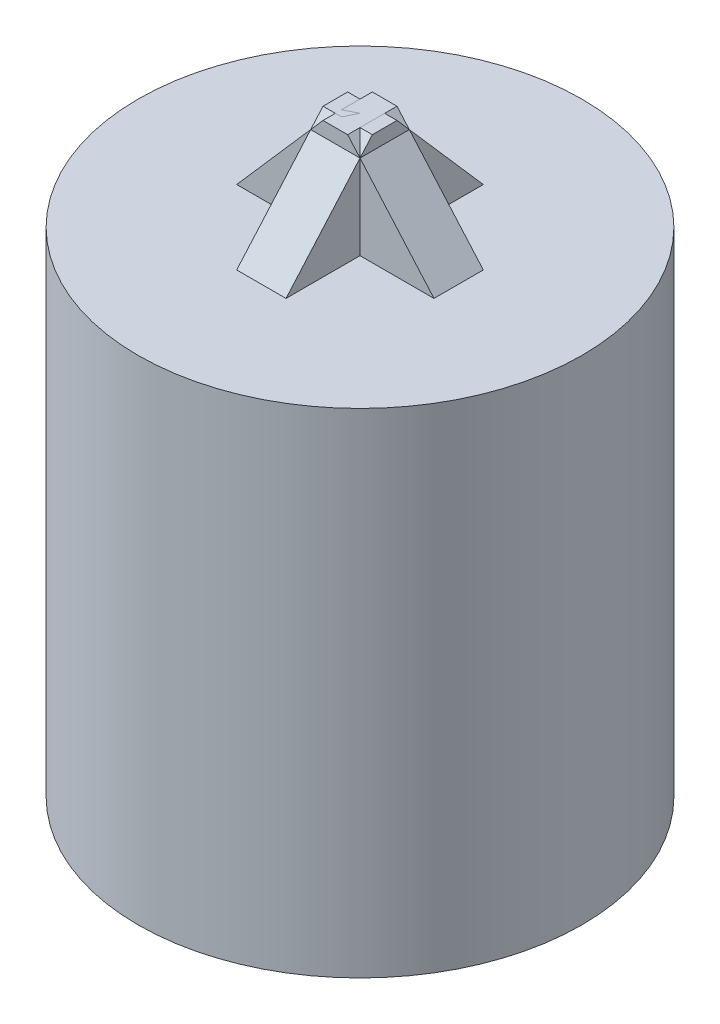
from build123d import *

# Parameters (mm, degrees)
SKETCH_1_R          = 4.5
SKETCH_1_W          = 2.5
SKETCH_1_H          = 3
EXTRUDE_1_DEPTH     = 10
SKETCH_2_W          = 2.5
SKETCH_2_H          = 3
CUT_EXTRUDE_1_DEPTH = 9
EXTRUDE_2_DEPTH     = 0.5
EXTRUDE_3_DEPTH     = 0.5


with BuildPart() as part:
    # Эскиз1 → Бобышка-Вытянуть1 (new body)
    # profile 1 of 2: a face of its own
    with BuildSketch(Plane(origin=(0, 0, 0), x_dir=(1, 0, 0), z_dir=(0, 1, 0))):
        with Locations(Location((0, 0, 0), (0, 0, 270))):
            Circle(SKETCH_1_R)
        with Locations((-0.25, 0)):
            Rectangle(SKETCH_1_W, SKETCH_1_H, mode=Mode.SUBTRACT)
    # profile 2 of 2: a face of its own
    with BuildSketch(Plane(origin=(0, 0, 0), x_dir=(1, 0, 0), z_dir=(0, 1, 0))):
        with Locations((-0.25, 0)):
            Rectangle(SKETCH_1_W, SKETCH_1_H)
    extrude(amount=EXTRUDE_1_DEPTH)

    # Эскиз2 → Вырез-Вытянуть1 (cut)
    with BuildSketch(Plane(origin=(0, 0, 0), x_dir=(1, 0, 0), z_dir=(0, 1, 0))):
        with Locations((-0.25, 0)):
            Rectangle(SKETCH_2_W, SKETCH_2_H)
    extrude(amount=CUT_EXTRUDE_1_DEPTH, mode=Mode.SUBTRACT)

    # Эскиз3 → Бобышка-Вытянуть2 (add, symmetric)
    with BuildSketch(Plane.XY):
        Polygon((2, 10), (-2, 10), (-0.25, 12), (0.25, 12), align=None)
    extrude(amount=EXTRUDE_2_DEPTH, both=True)


with BuildPart() as body_2:
    # Эскиз4 → Бобышка-Вытянуть3 (new, symmetric)
    with BuildSketch(Plane(origin=(0, 0, 0), x_dir=(0, 0, -1), z_dir=(1, 0, 0))):
        Polygon((2, 10), (-2, 10), (-0.25, 12), (0.25, 12), align=None)
    extrude(amount=EXTRUDE_3_DEPTH, both=True)


solid = Compound([part.part, body_2.part])
